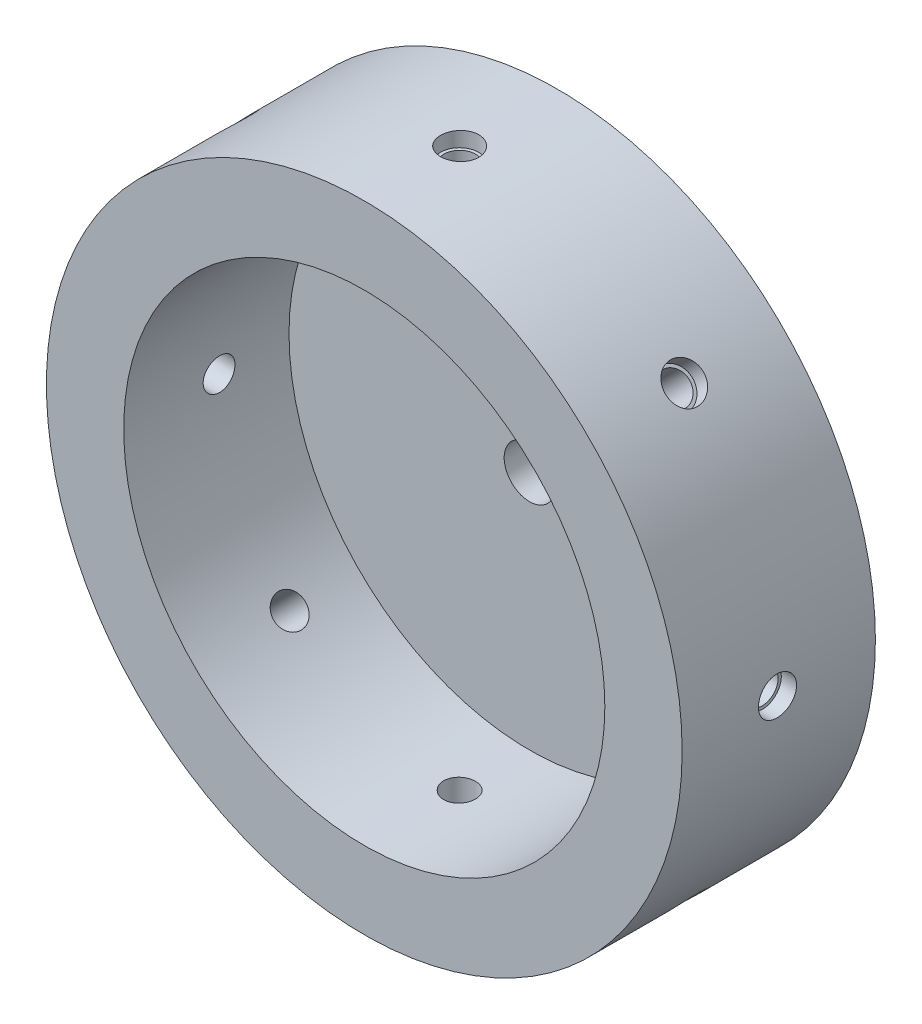
from build123d import *

# Parameters (mm, degrees)
SKETCH2_R                = 125
SKETCH2_R_2              = 94.6
BOSS_EXTRUDE1_DEPTH      = 75
BOSS_EXTRUDE2_DEPTH      = 1
BOSS_EXTRUDE2_DEPTH_BACK = 10
SKETCH3_R                = 125
SKETCH3_R_2              = 10
SKETCH4_R                = 7.5
CUT_EXTRUDE4_DEPTH       = 6
SKETCH7_R                = 6.25
CUT_EXTRUDE5_DEPTH       = 50
CIRPATTERN1_COUNT        = 8


with BuildPart() as part:
    # Sketch2 → Boss-Extrude1 (new body)
    with BuildSketch(Plane.XY):
        Circle(SKETCH2_R)
        Circle(SKETCH2_R_2, mode=Mode.SUBTRACT)
    extrude(amount=-BOSS_EXTRUDE1_DEPTH)

    # Sketch3 → Boss-Extrude2 (add, two sides: drawn at the far end of the back side and taken through both)
    with BuildSketch(Plane(origin=(0, 0, -75), x_dir=(-1, 0, 0), z_dir=(0, 0, -1)).offset(-BOSS_EXTRUDE2_DEPTH_BACK)):
        with Locations(Location((0, 0, 0), (0, 0, 180))):
            Circle(SKETCH3_R)
        Circle(SKETCH3_R_2, mode=Mode.SUBTRACT)
    extrude(amount=BOSS_EXTRUDE2_DEPTH + BOSS_EXTRUDE2_DEPTH_BACK)

    # Sketch4 → Cut-Extrude4 (cut)
    with BuildSketch(Plane(origin=(0, -125, 0), x_dir=(1, 0, 0), z_dir=(0, 1, 0))):
        with Locations(Location((0, 37.5, 0), (0, 0, 90))):
            Circle(SKETCH4_R)
    cut_extrude4 = extrude(amount=CUT_EXTRUDE4_DEPTH, mode=Mode.SUBTRACT)

    # Sketch7 → Cut-Extrude5 (cut)
    with BuildSketch(Plane.XZ.offset(119)):
        with Locations(Location((0, -37.5, 0), (0, 0, 270))):
            Circle(SKETCH7_R)
    cut_extrude5 = extrude(amount=-CUT_EXTRUDE5_DEPTH, mode=Mode.SUBTRACT)

    # CirPattern1: Cut-Extrude4, Cut-Extrude5 ×8 about axis
    cirpattern1_axis = Axis((0, 0, 0), (0, 0, 1))
    add([cut_extrude4.rotate(cirpattern1_axis, i * 360 / CIRPATTERN1_COUNT) for i in range(1, CIRPATTERN1_COUNT)], mode=Mode.SUBTRACT)
    add([cut_extrude5.rotate(cirpattern1_axis, i * 360 / CIRPATTERN1_COUNT) for i in range(1, CIRPATTERN1_COUNT)], mode=Mode.SUBTRACT)


solid = part.part
